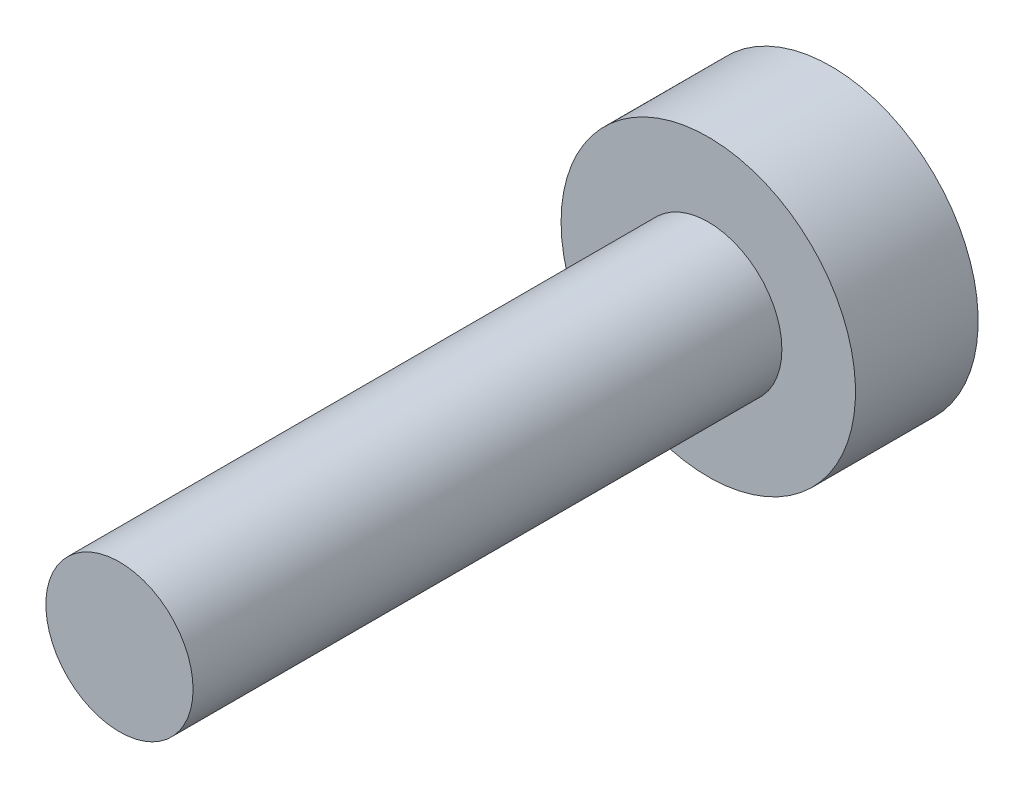
from build123d import *

# Parameters (mm, degrees)
SKETCH_1_R          = 1.5
EXTRUDE_1_DEPTH     = 12
SKETCH_2_R          = 3
EXTRUDE_2_DEPTH     = 2.5
CUT_EXTRUDE_3_DEPTH = 1


with BuildPart() as part:
    # 草图1 → 凸台-拉伸1 (new body)
    with BuildSketch(Plane.XY):
        with Locations((-5.944112119, 3.006217623)):
            Circle(SKETCH_1_R)
    extrude(amount=EXTRUDE_1_DEPTH)

    # 草图2 → 凸台-拉伸2 (add)
    with BuildSketch(Plane(origin=(0, 0, 0), x_dir=(-1, 0, 0), z_dir=(0, 0, -1))):
        with Locations((5.944112119, 3.006217623)):
            Circle(SKETCH_2_R)
    extrude(amount=EXTRUDE_2_DEPTH)

    # 草图4 → 切除-拉伸3 (cut)
    with BuildSketch(Plane(origin=(0, 0, -2.5), x_dir=(-1, 0, 0), z_dir=(0, 0, -1))):
        Polygon((3.944112119, 3.256217623), (5.694112119, 3.256217623), (5.694112119, 5.006217623), (6.194112119, 5.006217623), (6.194112119, 3.256217623), (7.944112119, 3.256217623), (7.944112119, 2.756217623), (6.194112119, 2.756217623), (6.194112119, 1.006217623), (5.694112119, 1.006217623), (5.694112119, 2.756217623), (3.944112119, 2.756217623), align=None)
    extrude(amount=-CUT_EXTRUDE_3_DEPTH, mode=Mode.SUBTRACT)


solid = part.part
